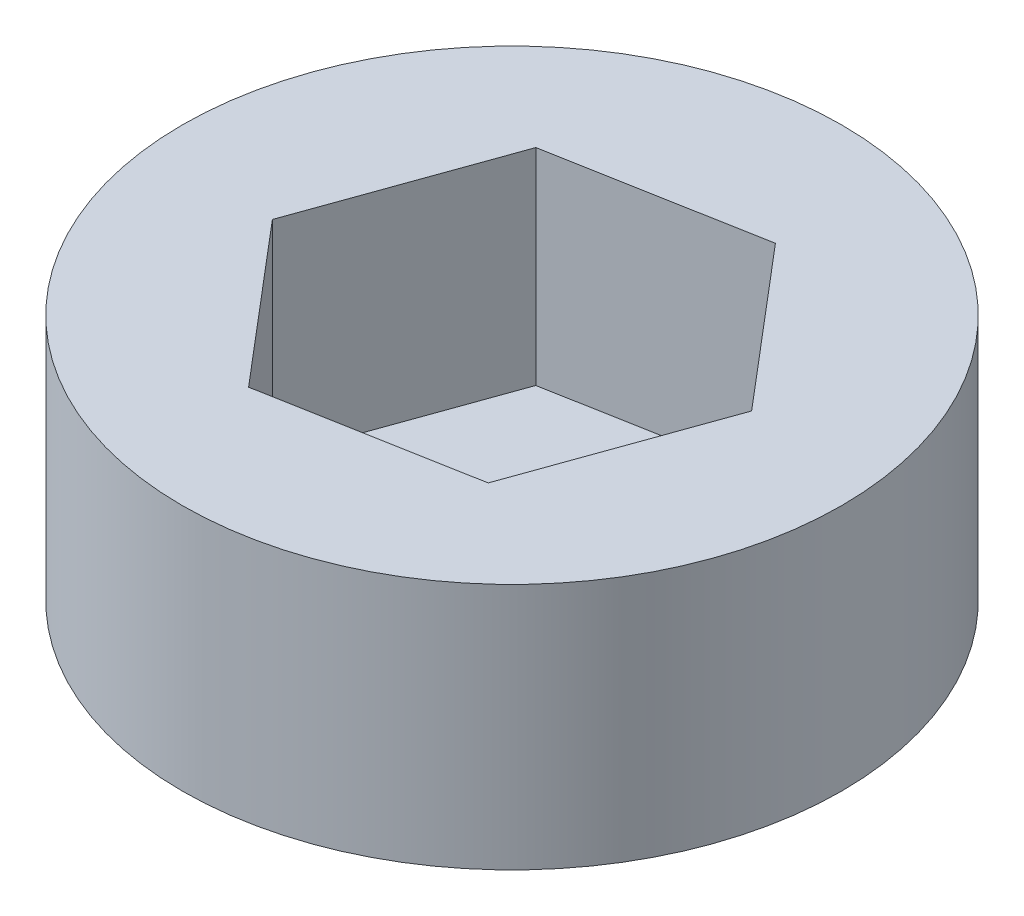
from build123d import *

# Parameters (mm, degrees)
SKETCH1_R           = 10.16
BOSS_EXTRUDE1_DEPTH = 7.62
SKETCH2_R           = 1.5875
CUT_EXTRUDE4_DEPTH  = 17.263935563
CUT_EXTRUDE5_DEPTH  = 6.35


with BuildPart() as part:
    # Sketch1 → Boss-Extrude1 (new body)
    with BuildSketch(Plane(origin=(0, 0, 0), x_dir=(1, 0, 0), z_dir=(0, 1, 0))):
        with Locations(Location((0, 0, 0), (0, 0, 90))):
            Circle(SKETCH1_R)
    extrude(amount=BOSS_EXTRUDE1_DEPTH)

    # Sketch2 → Cut-Extrude4 (cut, through all)
    with BuildSketch(Plane(origin=(0, 7.62, 0), x_dir=(1, 0, 0), z_dir=(0, 1, 0))):
        with Locations(Location((0, 0, 0), (0, 0, 270))):
            Circle(SKETCH2_R)
    extrude(amount=-CUT_EXTRUDE4_DEPTH, mode=Mode.SUBTRACT)

    # Sketch5 → Cut-Extrude5 (cut)
    with BuildSketch(Plane(origin=(0, 7.62, 0), x_dir=(1, 0, 0), z_dir=(0, 1, 0))):
        Polygon((6.247359776, 1.137099745), (2.138922622, 5.978922145), (-4.108437154, 4.8418224), (-6.247359776, -1.137099745), (-2.138922622, -5.978922145), (4.108437154, -4.8418224), align=None)
    extrude(amount=-CUT_EXTRUDE5_DEPTH, mode=Mode.SUBTRACT)


solid = part.part
